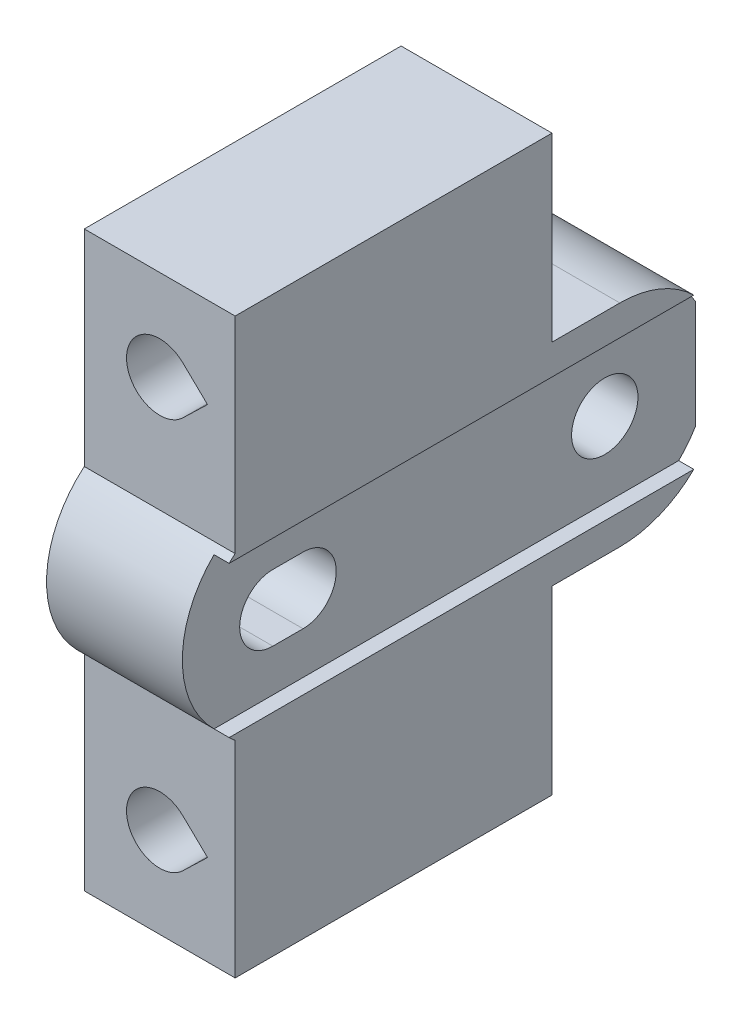
from build123d import *

# Parameters (mm, degrees)
BOSS_EXTRUDE1_DEPTH = 9
BOSS_EXTRUDE2_DEPTH = 1
BOSS_EXTRUDE3_DEPTH = 1
SKETCH4_W           = 10
SKETCH4_H           = 21
BOSS_EXTRUDE4_DEPTH = 12
SKETCH5_W           = 10
SKETCH5_H           = 21
BOSS_EXTRUDE5_DEPTH = 12
CUT_EXTRUDE1_DEPTH  = 34.693619574
CUT_EXTRUDE2_DEPTH  = 28.699277969
CUT_EXTRUDE3_DEPTH  = 34.693619574
HOLE1_D             = 4.4


with BuildPart() as part:
    # Sketch1 → Boss-Extrude1 (new body)
    with BuildSketch(Plane(origin=(4.9, 0, 0), x_dir=(0, -1, 0), z_dir=(-1, 0, 0))):
        with BuildLine():
            Line((7, -10.5), (7, 15))
            Line((7, 15), (5.361902647, 15))
            ThreePointArc((5.361902647, 15), (0, 17.5), (-5.361902647, 15))
            Line((-5.361902647, 15), (-7, 15))
            Line((-7, 15), (-7, -10.5))
            ThreePointArc((-7, -10.5), (-6.092571663, -13.946820352), (-3.605551275, -16.5))
            Line((-3.605551275, -16.5), (3.605551275, -16.5))
            ThreePointArc((3.605551275, -16.5), (6.092571663, -13.946820352), (7, -10.5))
        make_face()
    extrude(amount=-BOSS_EXTRUDE1_DEPTH)

    # Sketch2 → Boss-Extrude2 (add)
    with BuildSketch(Plane(origin=(13.9, 0, 0), x_dir=(0, 0, -1), z_dir=(1, 0, 0))):
        with BuildLine():
            Line((-15, -7), (-15, -5.361902647))
            ThreePointArc((-15, -5.361902647), (-15.202979206, -5.184784141), (-15.398993058, -4.999986702))
            Line((-15.398993058, -4.999986702), (15.398993058, -4.999986702))
            ThreePointArc((15.398993058, -4.999986702), (13.145760107, -6.480737107), (10.5, -7))
            Line((10.5, -7), (-15, -7))
        make_face()
    extrude(amount=BOSS_EXTRUDE2_DEPTH)

    # Sketch3 → Boss-Extrude3 (add)
    with BuildSketch(Plane(origin=(13.9, 0, 0), x_dir=(0, 0, -1), z_dir=(1, 0, 0))):
        with BuildLine():
            Line((-15, 7), (10.5, 7))
            ThreePointArc((10.5, 7), (13.145742515, 6.480744289), (15.398965913, 5.000013298))
            Line((15.398965913, 5.000013298), (-15.398965913, 5.000013298))
            ThreePointArc((-15.398965913, 5.000013298), (-15.202965132, 5.184796907), (-15, 5.361902647))
            Line((-15, 5.361902647), (-15, 7))
        make_face()
    extrude(amount=BOSS_EXTRUDE3_DEPTH)

    # Sketch4 → Boss-Extrude4 (add)
    with BuildSketch(Plane.XZ.offset(7)):
        with Locations((9.9, 4.5)):
            Rectangle(SKETCH4_W, SKETCH4_H)
    extrude(amount=BOSS_EXTRUDE4_DEPTH)

    # Sketch5 → Boss-Extrude5 (add)
    with BuildSketch(Plane(origin=(0, 7, 0), x_dir=(-1, 0, 0), z_dir=(0, 1, 0))):
        with Locations((-9.9, 4.5)):
            Rectangle(SKETCH5_W, SKETCH5_H)
    extrude(amount=BOSS_EXTRUDE5_DEPTH)

    # Sketch6 → Cut-Extrude1 (cut, through all)
    with BuildSketch(Plane(origin=(0, 0, -6), x_dir=(-1, 0, 0), z_dir=(0, 0, -1))):
        with BuildLine():
            Line((-11.428248415, 14.582547561), (-13.067024387, 13))
            Line((-13.067024387, 13), (-11.428248415, 11.417452439))
            ThreePointArc((-11.428248415, 11.417452439), (-7.7, 13), (-11.428248415, 14.582547561))
        make_face()
    extrude(amount=-CUT_EXTRUDE1_DEPTH, mode=Mode.SUBTRACT)

    # Sketch7 → Cut-Extrude2 (cut, through all)
    with BuildSketch(Plane.ZY.offset(-4.9)):
        with BuildLine():
            Line((9.5, -2.2), (11.5, -2.2))
            ThreePointArc((11.5, -2.2), (13.7, 0), (11.5, 2.2))
            Line((11.5, 2.2), (9.5, 2.2))
            ThreePointArc((9.5, 2.2), (7.3, 0), (9.5, -2.2))
        make_face()
    extrude(amount=-CUT_EXTRUDE2_DEPTH, mode=Mode.SUBTRACT)

    # Sketch8 → Cut-Extrude3 (cut, through all)
    with BuildSketch(Plane(origin=(0, 0, -6), x_dir=(-1, 0, 0), z_dir=(0, 0, -1))):
        with BuildLine():
            Line((-11.428248415, -11.417452439), (-13.067024387, -13))
            Line((-13.067024387, -13), (-11.428248415, -14.582547561))
            ThreePointArc((-11.428248415, -14.582547561), (-7.7, -13), (-11.428248415, -11.417452439))
        make_face()
    extrude(amount=-CUT_EXTRUDE3_DEPTH, mode=Mode.SUBTRACT)

    # Hole1 (through all)
    with Locations(Plane(origin=(13.9, 0, 0), x_dir=(0, 0, -1), z_dir=(1, 0, 0))):
        with Locations((10.5, 0)):
            Hole(HOLE1_D / 2)


solid = part.part
